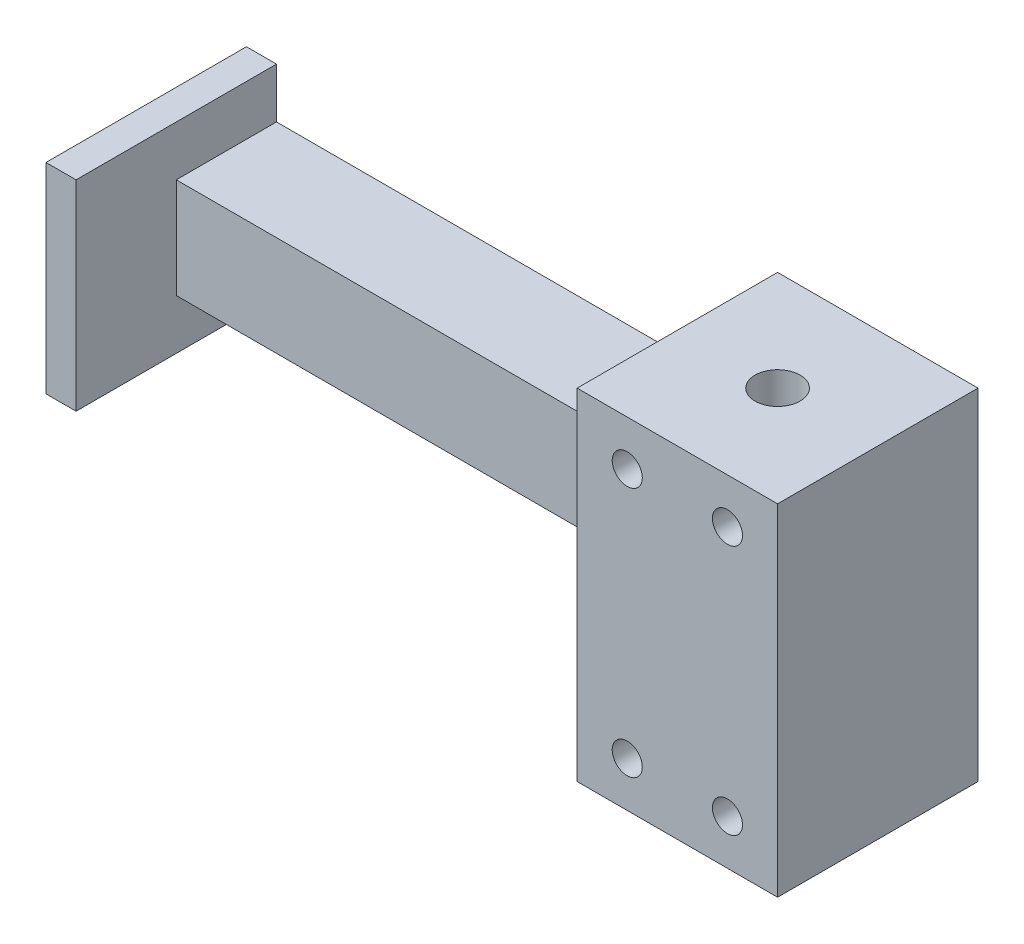
from build123d import *

# Parameters (mm, degrees)
MAIN_W                  = 20
MAIN_H                  = 34
MAIN_R                  = 1.5
MAIN_EXTRUSION_DEPTH    = 20
ESQUISSE2_R             = 2.25
ENL_V_MAT_EXTRU_1_DEPTH = 45.226688775
ESQUISSE3_W             = 10
ESQUISSE3_H             = 10
BOSS_EXTRU_3_DEPTH      = 50
ESQUISSE4_W             = 20
ESQUISSE4_H             = 20
BOSS_EXTRU_4_DEPTH      = 3


with BuildPart() as part:
    # Main → Main Extrusion (new body)
    with BuildSketch(Plane.XY):
        with Locations((10, 0)):
            Rectangle(MAIN_W, MAIN_H)
        with Locations((5, 12.5)):
            Circle(MAIN_R, mode=Mode.SUBTRACT)
        with Locations((15, 12.5)):
            Circle(MAIN_R, mode=Mode.SUBTRACT)
        with Locations((5, -12.5)):
            Circle(MAIN_R, mode=Mode.SUBTRACT)
        with Locations((15, -12.5)):
            Circle(MAIN_R, mode=Mode.SUBTRACT)
    extrude(amount=MAIN_EXTRUSION_DEPTH)

    # Esquisse2 → Enlèv. mat.-Extru.1 (cut, through all)
    with BuildSketch(Plane.XZ.offset(17)):
        with Locations(Location((10, 10, 0), (0, 0, 270))):
            Circle(ESQUISSE2_R)
    extrude(amount=-ENL_V_MAT_EXTRU_1_DEPTH, mode=Mode.SUBTRACT)

    # Esquisse3 → Boss.-Extru.3 (add)
    with BuildSketch(Plane.ZY):
        with Locations((5, 0)):
            Rectangle(ESQUISSE3_W, ESQUISSE3_H)
    extrude(amount=BOSS_EXTRU_3_DEPTH)

    # Esquisse4 → Boss.-Extru.4 (add)
    with BuildSketch(Plane.ZY.offset(50)):
        with Locations((10, 0)):
            Rectangle(ESQUISSE4_W, ESQUISSE4_H)
    extrude(amount=BOSS_EXTRU_4_DEPTH)


solid = part.part
